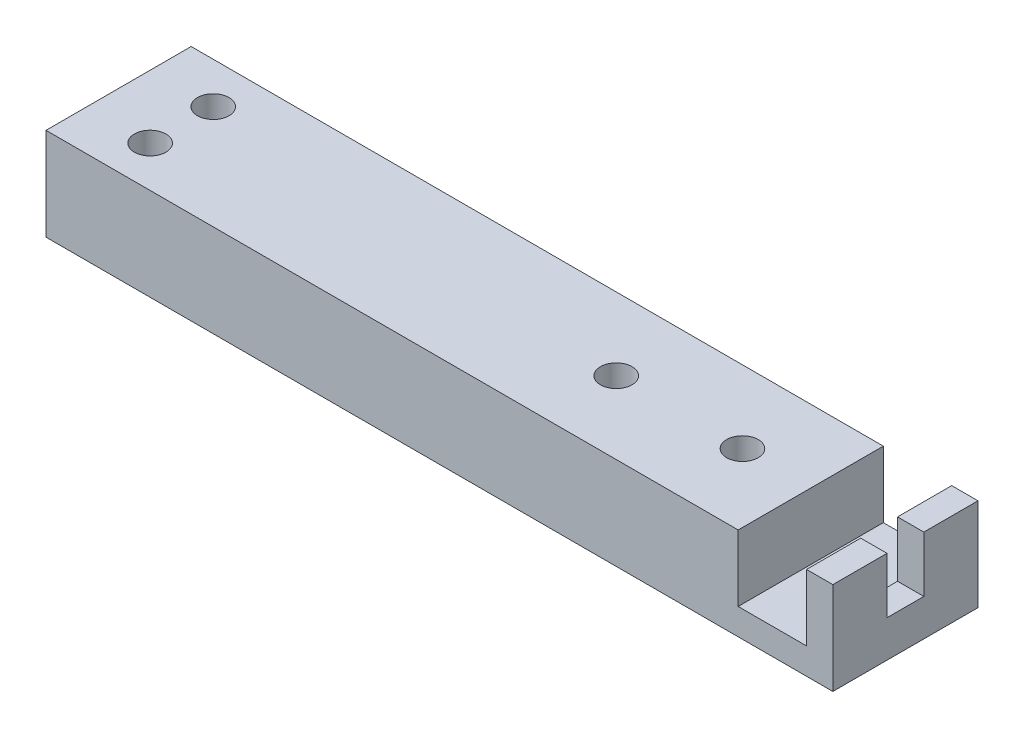
from build123d import *

# Parameters (mm, degrees)
SKETCH1_W           = 74.8
SKETCH1_H           = 13.8
BOSS_EXTRUDE1_DEPTH = 8.8
SKETCH2_W           = 6.5
SKETCH2_H           = 13.8
CUT_EXTRUDE1_DEPTH  = 6.3
SKETCH3_W           = 3.5
SKETCH3_H           = 5.3
CUT_EXTRUDE2_DEPTH  = 2.8
SKETCH4_R           = 1.5
CUT_EXTRUDE3_DEPTH  = 7
SKETCH5_R           = 1.5
CUT_EXTRUDE4_DEPTH  = 8


with BuildPart() as part:
    # Sketch1 → Boss-Extrude1 (new body)
    with BuildSketch(Plane(origin=(0, 0, 0), x_dir=(1, 0, 0), z_dir=(0, 1, 0))):
        Rectangle(SKETCH1_W, SKETCH1_H)
    extrude(amount=BOSS_EXTRUDE1_DEPTH)

    # Sketch2 → Cut-Extrude1 (cut)
    with BuildSketch(Plane(origin=(0, 8.8, 0), x_dir=(1, 0, 0), z_dir=(0, 1, 0))):
        with Locations((31.65, 0)):
            Rectangle(SKETCH2_W, SKETCH2_H)
    extrude(amount=-CUT_EXTRUDE1_DEPTH, mode=Mode.SUBTRACT)

    # Sketch3 → Cut-Extrude2 (cut)
    with BuildSketch(Plane(origin=(37.4, 0, 0), x_dir=(0, 0, -1), z_dir=(1, 0, 0))):
        with Locations((0, 6.15)):
            Rectangle(SKETCH3_W, SKETCH3_H)
    extrude(amount=-CUT_EXTRUDE2_DEPTH, mode=Mode.SUBTRACT)

    # Sketch4 → Cut-Extrude3 (cut)
    with BuildSketch(Plane(origin=(0, 8.8, 0), x_dir=(1, 0, 0), z_dir=(0, 1, 0))):
        with Locations(Location((21.91, 0, 0), (0, 0, 270))):
            Circle(SKETCH4_R)
        with Locations(Location((9.91, 0, 0), (0, 0, 270))):
            Circle(SKETCH4_R)
    extrude(amount=-CUT_EXTRUDE3_DEPTH, mode=Mode.SUBTRACT)

    # Sketch5 → Cut-Extrude4 (cut)
    with BuildSketch(Plane(origin=(0, 8.8, 0), x_dir=(1, 0, 0), z_dir=(0, 1, 0))):
        with Locations(Location((-31.4, 3, 0), (0, 0, 270))):
            Circle(SKETCH5_R)
        with Locations(Location((-31.4, -3, 0), (0, 0, 270))):
            Circle(SKETCH5_R)
    extrude(amount=-CUT_EXTRUDE4_DEPTH, mode=Mode.SUBTRACT)


solid = part.part
